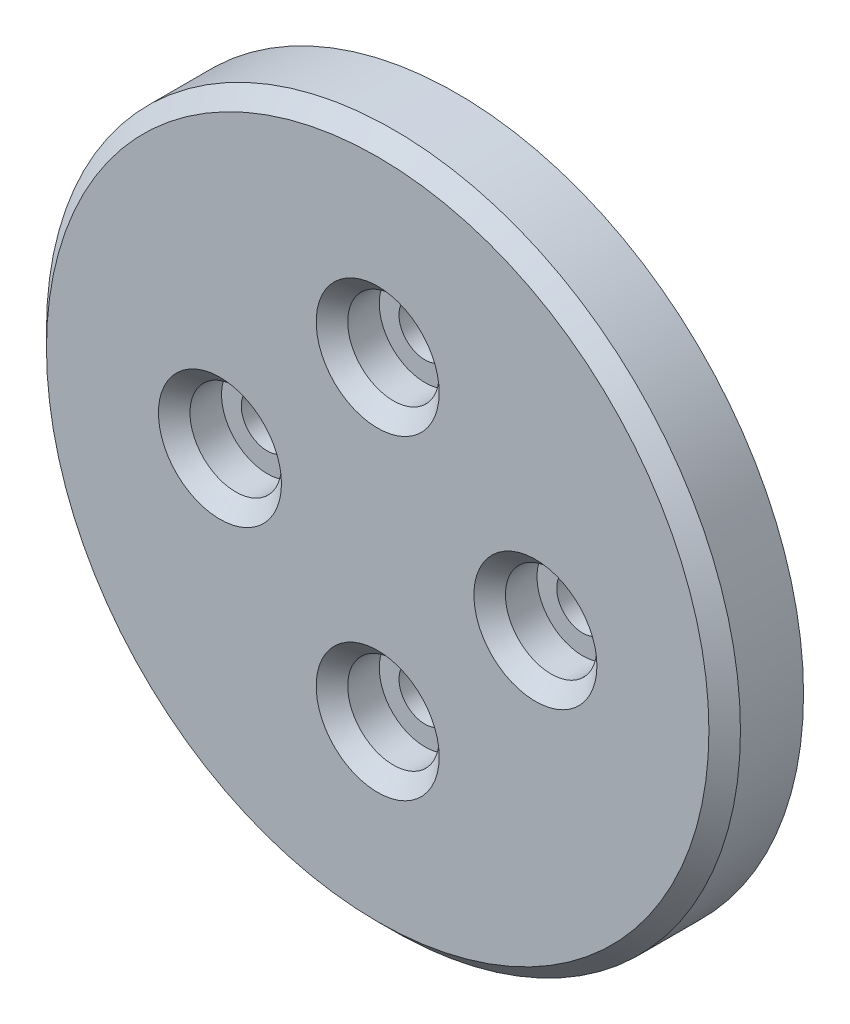
from build123d import *

# Parameters (mm, degrees)
SKIZZE1_R                       = 22
SKIZZE1_R_2                     = 1.65
AUFSATZ_LINEAR_AUSTRAGEN1_DEPTH = 5
SKIZZE2_R                       = 2.9
SCHNITT_LINEAR_AUSTRAGEN1_DEPTH = 3
VERRUNDUNG1_SIZE                = 1


with BuildPart() as part:
    # Skizze1 → Aufsatz-Linear austragen1 (new body)
    with BuildSketch(Plane.XY):
        Circle(SKIZZE1_R)
        with Locations((10, 0)):
            Circle(SKIZZE1_R_2, mode=Mode.SUBTRACT)
        with Locations((0, -10)):
            Circle(SKIZZE1_R_2, mode=Mode.SUBTRACT)
        with Locations((-10, 0)):
            Circle(SKIZZE1_R_2, mode=Mode.SUBTRACT)
        with Locations((0, 10)):
            Circle(SKIZZE1_R_2, mode=Mode.SUBTRACT)
    extrude(amount=AUFSATZ_LINEAR_AUSTRAGEN1_DEPTH)

    # Skizze2 → Schnitt-Linear austragen1 (cut)
    with BuildSketch(Plane.XY.offset(5)):
        with Locations((0, 10)):
            Circle(SKIZZE2_R)
        with Locations((10, 0)):
            Circle(SKIZZE2_R)
        with Locations((0, -10)):
            Circle(SKIZZE2_R)
        with Locations((-10, 0)):
            Circle(SKIZZE2_R)
    extrude(amount=-SCHNITT_LINEAR_AUSTRAGEN1_DEPTH, mode=Mode.SUBTRACT)

    # Verrundung1
    verrundung1_edges = [part.edges().sort_by_distance(p)[0] for p in [
        (-2.9, 10, 5),
        (7.1, 0, 5),
        (-22, 0, 5),
        (-2.9, -10, 5),
        (-12.9, 0, 5),
    ]]
    chamfer(verrundung1_edges, length=VERRUNDUNG1_SIZE)


solid = part.part
